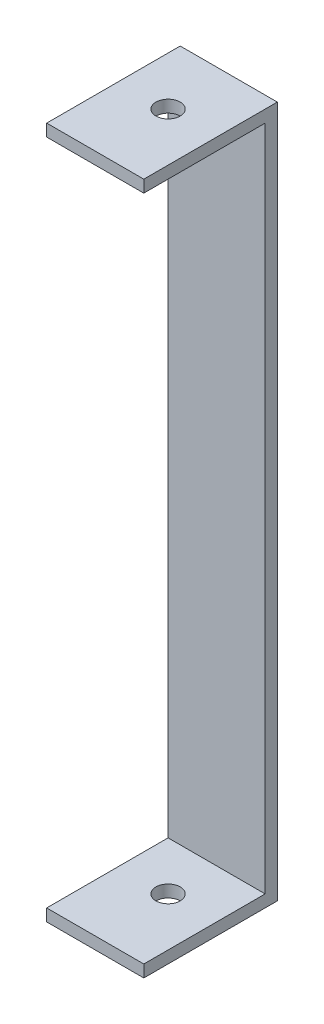
from build123d import *

# Parameters (mm, degrees)
SKETCH1_W           = 16
SKETCH1_H           = 114
BOSS_EXTRUDE2_DEPTH = 2
SKETCH2_W           = 16
SKETCH2_H           = 2
BOSS_EXTRUDE3_DEPTH = 20
SKETCH3_W           = 16
SKETCH3_H           = 2
BOSS_EXTRUDE4_DEPTH = 20
SKETCH4_R           = 2
CUT_EXTRUDE2_DEPTH  = 118.247641795


with BuildPart() as part:
    # Sketch1 → Boss-Extrude2 (new body)
    with BuildSketch(Plane.XY):
        with Locations((8.340425532, 57.170212766)):
            Rectangle(SKETCH1_W, SKETCH1_H)
    extrude(amount=BOSS_EXTRUDE2_DEPTH)

    # Sketch2 → Boss-Extrude3 (add)
    with BuildSketch(Plane.XY.offset(2)):
        with Locations((8.340425532, 113.170212766)):
            Rectangle(SKETCH2_W, SKETCH2_H)
    extrude(amount=BOSS_EXTRUDE3_DEPTH)

    # Sketch3 → Boss-Extrude4 (add)
    with BuildSketch(Plane.XY.offset(2)):
        with Locations((8.340425532, 1.170212766)):
            Rectangle(SKETCH3_W, SKETCH3_H)
    extrude(amount=BOSS_EXTRUDE4_DEPTH)

    # Sketch4 → Cut-Extrude2 (cut, through all)
    with BuildSketch(Plane(origin=(0, 114.170212766, 0), x_dir=(1, 0, 0), z_dir=(0, 1, 0))):
        with Locations(Location((8.340425532, -10, 0), (0, 0, 270))):
            Circle(SKETCH4_R)
    extrude(amount=-CUT_EXTRUDE2_DEPTH, mode=Mode.SUBTRACT)


solid = part.part
